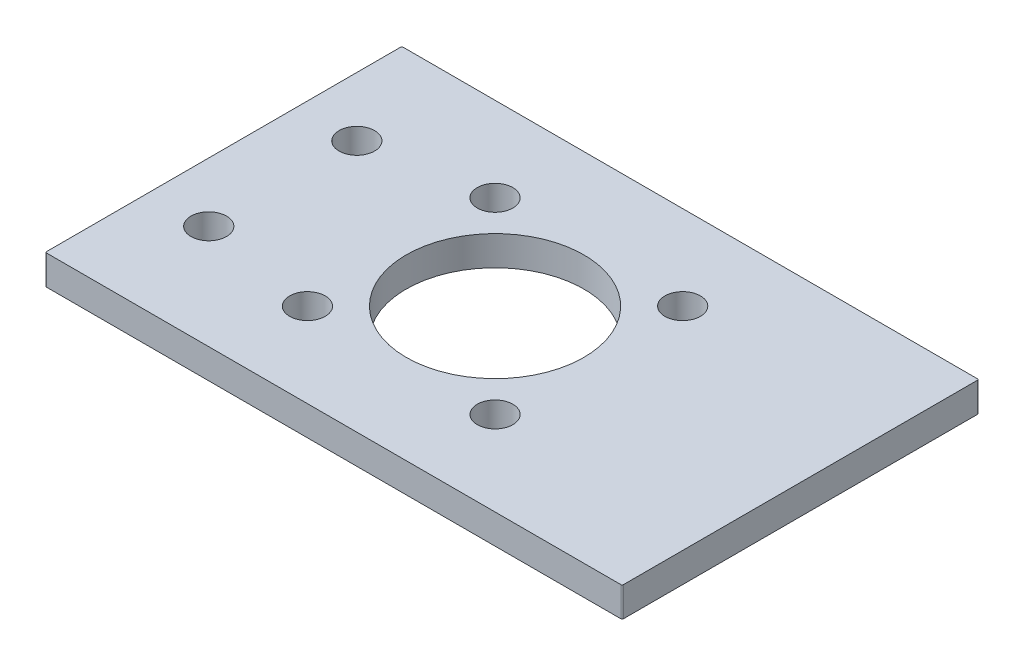
from build123d import *

# Parameters (mm, degrees)
SKETCH1_W           = 123.698
SKETCH1_H           = 76.454
BOSS_EXTRUDE1_DEPTH = 6.35
SKETCH6_R           = 19.05
SKETCH6_R_2         = 3.81
CUT_EXTRUDE5_DEPTH  = 73.985785123
FILLET1_R           = 0.254


with BuildPart() as part:
    # Sketch1 → Boss-Extrude1 (new body)
    with BuildSketch(Plane(origin=(0, 0, 0), x_dir=(1, 0, 0), z_dir=(0, 1, 0))):
        Rectangle(SKETCH1_W, SKETCH1_H)
    extrude(amount=BOSS_EXTRUDE1_DEPTH)

    # Sketch6 → Cut-Extrude5 (cut, through all)
    with BuildSketch(Plane(origin=(0, 6.35, 0), x_dir=(1, 0, 0), z_dir=(0, 1, 0))):
        with Locations(Location((-3.633226289, 0, 0), (0, 0, 270))):
            Circle(SKETCH6_R)
        with Locations(Location((16.482547422, 20.115773711, 0), (0, 0, 270))):
            Circle(SKETCH6_R_2)
        with Locations(Location((-23.749, 20.115773711, 0), (0, 0, 270))):
            Circle(SKETCH6_R_2)
        with Locations(Location((-23.749, -20.115773711, 0), (0, 0, 270))):
            Circle(SKETCH6_R_2)
        with Locations(Location((16.482547422, -20.115773711, 0), (0, 0, 270))):
            Circle(SKETCH6_R_2)
        with Locations(Location((-49.149, 15.875, 0), (0, 0, 270))):
            Circle(SKETCH6_R_2)
        with Locations(Location((-49.149, -15.875, 0), (0, 0, 270))):
            Circle(SKETCH6_R_2)
    extrude(amount=-CUT_EXTRUDE5_DEPTH, mode=Mode.SUBTRACT)

    # Fillet1
    fillet1_edges = [part.edges().sort_by_distance(p)[0] for p in [
        (61.849, 3.175, 38.227),
        (-61.849, 3.175, 38.227),
        (-61.849, 3.175, -38.227),
        (61.849, 3.175, -38.227),
    ]]
    fillet(fillet1_edges, radius=FILLET1_R)


solid = part.part
